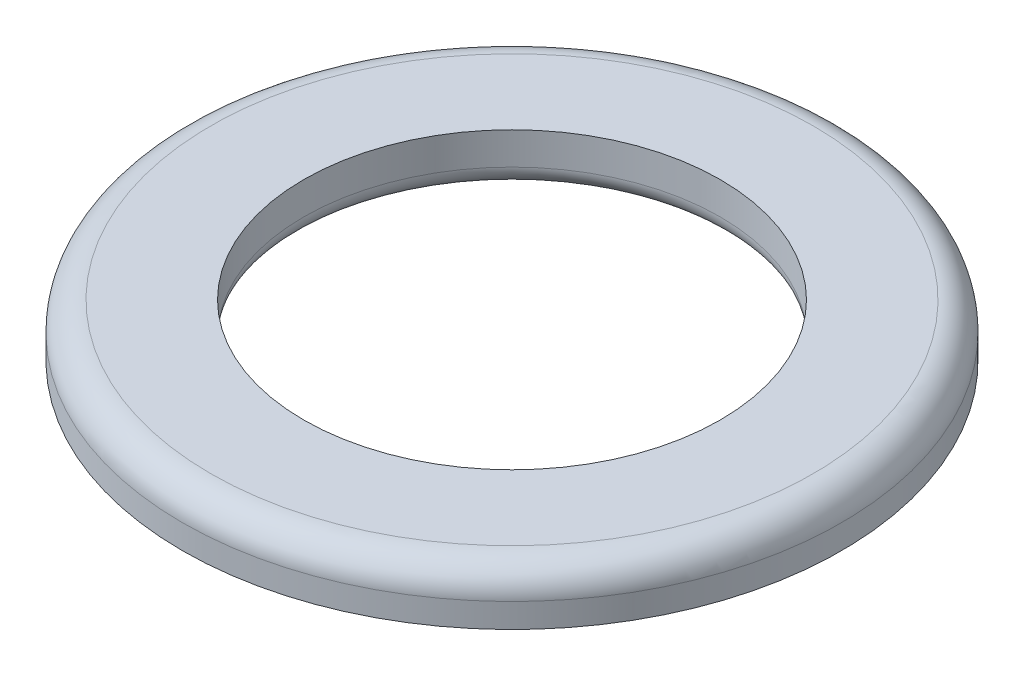
from build123d import *

# Parameters (mm, degrees)
SKETCH1_R           = 8.15
SKETCH1_R_2         = 5.15
BOSS_EXTRUDE1_DEPTH = 1.3
FILLET3_R           = 0.7
FILLET4_R           = 0.5


with BuildPart() as part:
    # Sketch1 → Boss-Extrude1 (new body)
    with BuildSketch(Plane(origin=(0, 0, 0), x_dir=(1, 0, 0), z_dir=(0, 1, 0))):
        with Locations(Location((0, 0, 0), (0, 0, 270))):
            Circle(SKETCH1_R)
        with Locations(Location((0, 0, 0), (0, 0, 270))):
            Circle(SKETCH1_R_2, mode=Mode.SUBTRACT)
    extrude(amount=BOSS_EXTRUDE1_DEPTH)

    # Fillet3
    fillet3_edges = [part.edges().sort_by_distance(p)[0] for p in [
        (0, 1.3, -8.15),
    ]]
    fillet(fillet3_edges, radius=FILLET3_R)

    # Fillet4
    fillet4_edges = [part.edges().sort_by_distance(p)[0] for p in [
        (0, 0, -5.15),
    ]]
    fillet(fillet4_edges, radius=FILLET4_R)


solid = part.part
